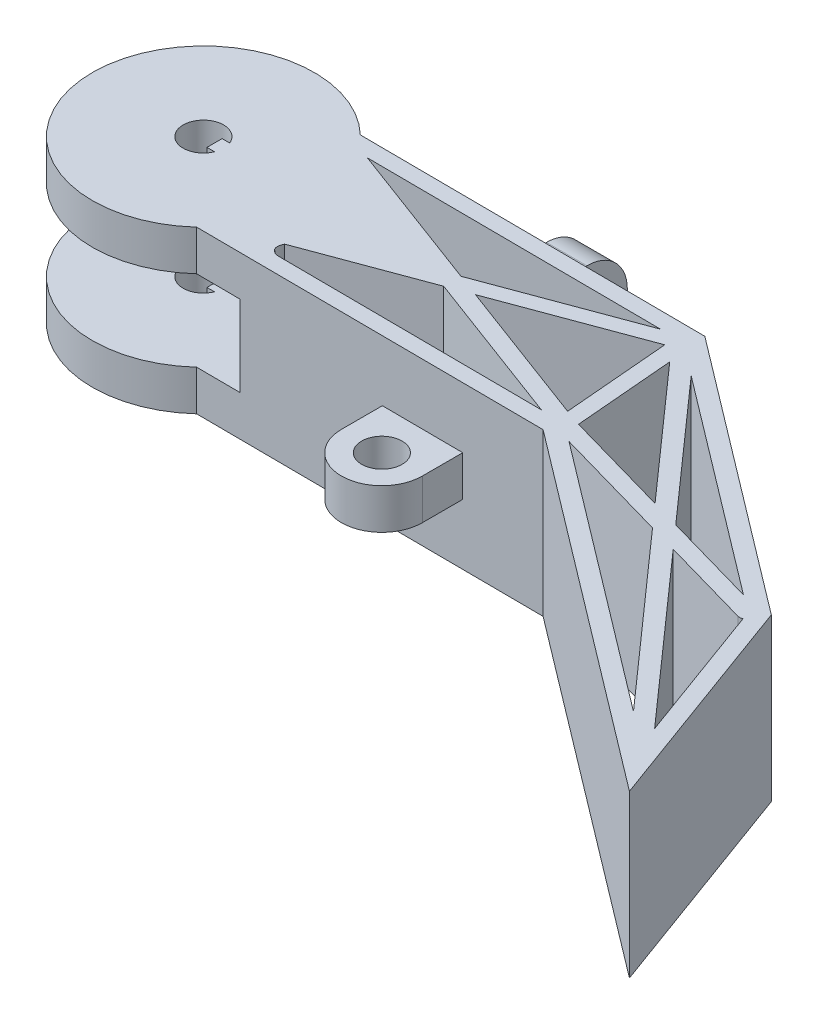
from build123d import *

# Parameters (mm, degrees)
BOSS_EXTRUDE4_DEPTH      = 12.7
SKETCH4_R                = 17.653445752
CUT_EXTRUDE1_DEPTH       = 6.35
CUT_EXTRUDE2_DEPTH       = 6.35
CUT_EXTRUDE5_DEPTH       = 109.881733746
BOSS_EXTRUDE6_DEPTH      = 3.175
BOSS_EXTRUDE6_DEPTH_BACK = 3.175
SKETCH9_R                = 3.175
BOSS_EXTRUDE7_DEPTH      = 3.175
BOSS_EXTRUDE7_DEPTH_BACK = 3.175
SKETCH10_R               = 3.175


with BuildPart() as part:
    # Sketch2 → Boss-Extrude4 (new body)
    with BuildSketch(Plane(origin=(0, 0, 0), x_dir=(1, 0, 0), z_dir=(0, 1, 0))):
        with BuildLine():
            Line((-2.387880417, -18.841306965), (53.578976921, -61.247629626))
            Line((53.578976921, -61.247629626), (40.727486813, -26.109986808))
            Line((40.727486813, -26.109986808), (-2.387867851, 6.558698348))
            Line((-2.387867851, 6.558698348), (-56.830809788, 6.896210087))
            ThreePointArc((-56.830809788, 6.896210087), (-86.36301081, -5.439598854), (-57.144853521, -18.501848432))
            Line((-57.144853521, -18.501848432), (-2.387880417, -18.841306965))
        make_face()
        with BuildLine():
            Line((-65.987192171, -6.845774662), (-67.177817171, -6.845774662))
            Line((-67.177817171, -6.845774662), (-67.177817171, -4.464524662))
            Line((-67.177817171, -4.464524662), (-65.987192171, -4.464524662))
            ThreePointArc((-65.987192171, -4.464524662), (-72.105495945, -5.655149662), (-65.987192171, -6.845774662))
        make_face(mode=Mode.SUBTRACT)
    boss_extrude4 = extrude(amount=BOSS_EXTRUDE4_DEPTH)

    # Sketch4 → Cut-Extrude1 (cut)
    with BuildSketch(Plane(origin=(0, 12.7, 0), x_dir=(1, 0, 0), z_dir=(0, 1, 0))):
        with Locations((-68.930495945, -5.655149662)):
            Circle(SKETCH4_R)
    cut_extrude1 = extrude(amount=-CUT_EXTRUDE1_DEPTH, mode=Mode.SUBTRACT)

    # Triangleout → Cut-Extrude2 (cut)
    with BuildSketch(Plane(origin=(0, 6.35, 0), x_dir=(1, 0, 0), z_dir=(0, 1, 0))):
        Polygon((-58.106305107, -19.510345754), (-49.809105951, -19.510345754), (-52.888981235, -13.024949709), align=None)
    cut_extrude2 = extrude(amount=CUT_EXTRUDE2_DEPTH, mode=Mode.SUBTRACT)

    # Mirror3: Boss-Extrude4, Cut-Extrude1, Cut-Extrude2 across plane
    add(boss_extrude4.mirror(Plane(origin=(-68.930495945, 12.7, 5.655149662), x_dir=(0, 0, 1), z_dir=(0, -1, 0))))
    add(cut_extrude1.mirror(Plane(origin=(-68.930495945, 12.7, 5.655149662), x_dir=(0, 0, 1), z_dir=(0, -1, 0))), mode=Mode.SUBTRACT)
    add(cut_extrude2.mirror(Plane(origin=(-68.930495945, 12.7, 5.655149662), x_dir=(0, 0, 1), z_dir=(0, -1, 0))), mode=Mode.SUBTRACT)

    # Sketch5 → Cut-Extrude5 (cut, through all)
    with BuildSketch(Plane(origin=(0, 25.4, 0), x_dir=(1, 0, 0), z_dir=(0, 1, 0))):
        with BuildLine():
            Line((24.099631315, -24.892755187), (47.034088631, -50.747669189))
            Line((47.034088631, -50.747669189), (39.03471101, -28.876331991))
            ThreePointArc((39.03471101, -28.876331991), (38.645676848, -28.952727466), (38.252042628, -28.905441646))
            Line((38.252042628, -28.905441646), (24.099631315, -24.892755187))
        make_face()
        Polygon((1.256640277, -18.415995941), (43.047568139, -50.081157351), (19.563456511, -23.606596468), align=None)
        Polygon((-0.335913055, -15.324329604), (16.434626788, -20.079343901), (-1.660316127, 0.319795544), align=None)
        Polygon((1.929156818, 0.100890993), (20.970801592, -21.365502621), (35.814534972, -25.574202228), align=None)
        with BuildLine():
            Line((-47.081442632, -16.024186394), (-5.218084554, -16.283712685))
            Line((-5.218084554, -16.283712685), (-29.69599423, -7.140722356))
            Line((-29.69599423, -7.140722356), (-47.914378424, -13.898443659))
            add(Edge.make_bspline(
                [(-47.081442632, -16.024186394), (-48.684668247, -15.466043094), (-47.914378424, -13.898443659)],
                knots=[0, 0, 0, 1, 1, 1], degree=2))
        make_face()
        Polygon((-26.05383136, -5.78973967), (-2.9619803, -14.4150093), (-4.373004357, 2.252300993), align=None)
        Polygon((-29.692909923, -4.430470821), (-6.840209692, 4.046251237), (-53.155770657, 4.333378365), align=None)
    extrude(amount=-CUT_EXTRUDE5_DEPTH, mode=Mode.SUBTRACT)

    # Sketch10 → Boss-Extrude7 (add, two sides: drawn at the far end of the back side and taken through both)
    with BuildSketch(Plane.XZ.offset(-12.7).offset(-BOSS_EXTRUDE7_DEPTH_BACK)):
        with BuildLine():
            Line((-27.787880417, 18.683843062), (-15.087880417, 18.762575013))
            Line((-15.087880417, 18.762575013), (-15.087880417, 25.112575013))
            ThreePointArc((-15.087880417, 25.112575013), (-21.437880417, 31.462575013), (-27.787880417, 25.112575013))
            Line((-27.787880417, 25.112575013), (-27.787880417, 18.683843062))
        make_face()
        with Locations((-21.437880417, 25.112575013)):
            Circle(SKETCH10_R, mode=Mode.SUBTRACT)
    extrude(amount=BOSS_EXTRUDE7_DEPTH + BOSS_EXTRUDE7_DEPTH_BACK)


with BuildPart() as body_2:
    # Sketch9 → Boss-Extrude6 (new, two sides: drawn at the far end of the back side and taken through both)
    with BuildSketch(Plane.ZY.offset(30.767363181).offset(-BOSS_EXTRUDE6_DEPTH_BACK)):
        with BuildLine():
            Line((-13.244249221, 19.05), (-6.894249221, 19.05))
            Line((-6.894249221, 19.05), (-6.894249221, 6.35))
            Line((-6.894249221, 6.35), (-13.244249221, 6.35))
            ThreePointArc((-13.244249221, 6.35), (-19.594249221, 12.7), (-13.244249221, 19.05))
        make_face()
        with Locations((-13.244249221, 12.7)):
            Circle(SKETCH9_R, mode=Mode.SUBTRACT)
    extrude(amount=BOSS_EXTRUDE6_DEPTH + BOSS_EXTRUDE6_DEPTH_BACK)


solid = Compound([part.part, body_2.part])
